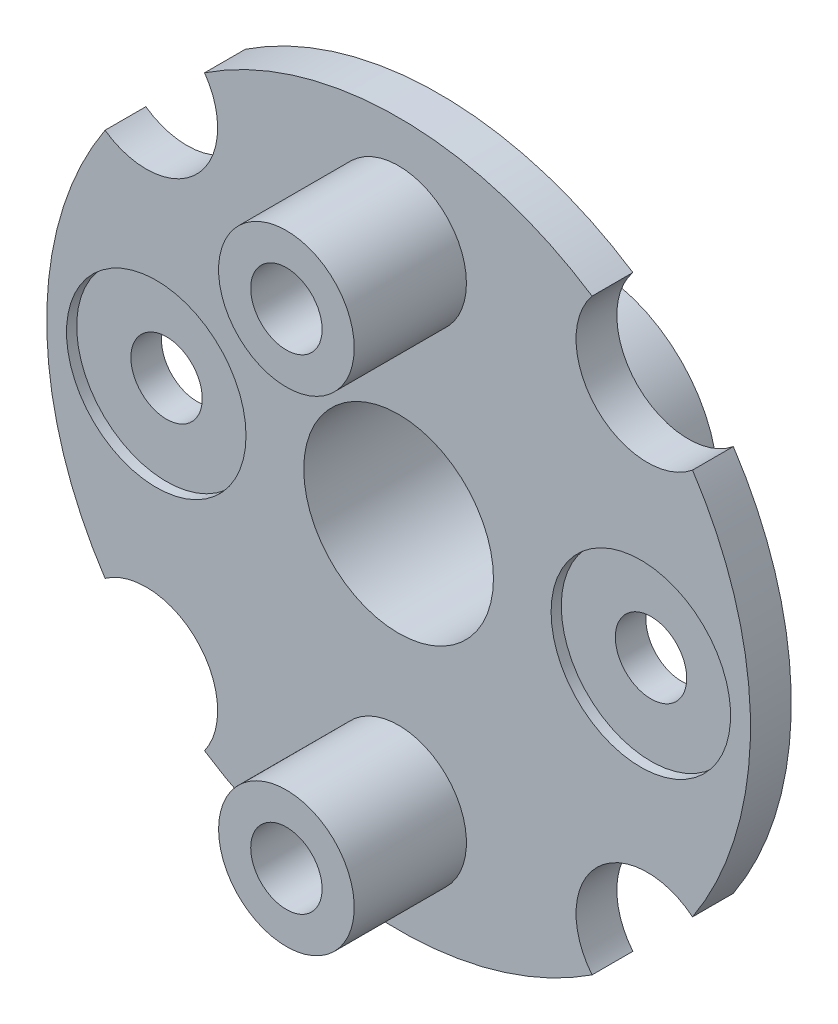
from build123d import *
from build123d.topology import SkipClean

# Parameters (mm, degrees)
ESQUISSE1_R             = 1.75
ESQUISSE1_R_2           = 4.65
BOSS_EXTRU_1_DEPTH      = 2
BOSS_EXTRU_2_START      = 7.5
ESQUISSE2_R             = 6.15
ESQUISSE2_R_2           = 4.65
BOSS_EXTRU_2_DEPTH      = 7.5
ESQUISSE3_R             = 3.325
ESQUISSE3_R_2           = 1.75
BOSS_EXTRU_3_DEPTH      = 5.5
ESQUISSE4_R             = 4.4
ENL_V_MAT_EXTRU_1_DEPTH = 0.5


with BuildPart() as part:
    # Esquisse1 → Boss.-Extru.1 (new body)
    with BuildSketch(Plane.XY):
        with BuildLine():
            ThreePointArc((-9.512110845, 14.390352576), (-9.895511173, 9.895511173), (-14.390352576, 9.512110845))
            ThreePointArc((-14.390352576, 9.512110845), (-17.25, 0), (-14.390352576, -9.512110845))
            ThreePointArc((-14.390352576, -9.512110845), (-9.895511173, -9.895511173), (-9.512110845, -14.390352576))
            ThreePointArc((-9.512110845, -14.390352576), (-0.01659063, -17.249992022), (9.484412678, -14.408622979))
            ThreePointArc((9.484412678, -14.408622979), (9.722718241, -9.722718241), (14.408622979, -9.484412678))
            ThreePointArc((14.408622979, -9.484412678), (17.25, 0), (14.408622979, 9.484412678))
            ThreePointArc((14.408622979, 9.484412678), (9.722718241, 9.722718241), (9.484412678, 14.408622979))
            ThreePointArc((9.484412678, 14.408622979), (-0.01659063, 17.249992022), (-9.512110845, 14.390352576))
        make_face()
        with Locations((0, -11.875)):
            Circle(ESQUISSE1_R, mode=Mode.SUBTRACT)
        with Locations((-11.875, 0)):
            Circle(ESQUISSE1_R, mode=Mode.SUBTRACT)
        Circle(ESQUISSE1_R_2, mode=Mode.SUBTRACT)
        with Locations((11.875, 0)):
            Circle(ESQUISSE1_R, mode=Mode.SUBTRACT)
        with Locations((0, 11.875)):
            Circle(ESQUISSE1_R, mode=Mode.SUBTRACT)
    extrude(amount=BOSS_EXTRU_1_DEPTH)

    # Esquisse2 → Boss.-Extru.2 (add)
    with SkipClean():  # the faces are left unmerged after this step: merging them gives an invalid solid
        with BuildSketch(Plane(origin=(0, 0, 0), x_dir=(-1, 0, 0), z_dir=(0, 0, -1)).offset(BOSS_EXTRU_2_START)):
            with Locations(Location((0, 0, 0), (0, 0, 180))):
                Circle(ESQUISSE2_R)
            Circle(ESQUISSE2_R_2, mode=Mode.SUBTRACT)
        extrude(amount=-BOSS_EXTRU_2_DEPTH)

    # Esquisse3 → Boss.-Extru.3 (add)
    # profile 1 of 2: a face of its own
    with SkipClean():  # the faces are left unmerged after this step: merging them gives an invalid solid
        with BuildSketch(Plane.XY.offset(2)):
            with Locations((0, 11.875)):
                Circle(ESQUISSE3_R)
            with Locations((0, 11.875)):
                Circle(ESQUISSE3_R_2, mode=Mode.SUBTRACT)
        # profile 2 of 2: a face of its own
        with BuildSketch(Plane.XY.offset(2)):
            with Locations(Location((0, -11.875, 0), (0, 0, 180))):
                Circle(ESQUISSE3_R)
            with Locations(Location((0, -11.875, 0), (0, 0, 180))):
                Circle(ESQUISSE3_R_2, mode=Mode.SUBTRACT)
        extrude(amount=BOSS_EXTRU_3_DEPTH)

    # Esquisse4 → Enlèv. mat.-Extru.1 (cut)
    with SkipClean():  # the faces are left unmerged after this step: merging them gives an invalid solid
        with BuildSketch(Plane.XY.offset(2)):
            with Locations((-11.88, 0)):
                Circle(ESQUISSE4_R)
            with Locations(Location((11.875, 0, 0), (0, 0, 180))):
                Circle(ESQUISSE4_R)
        extrude(amount=-ENL_V_MAT_EXTRU_1_DEPTH, mode=Mode.SUBTRACT)


solid = part.part
